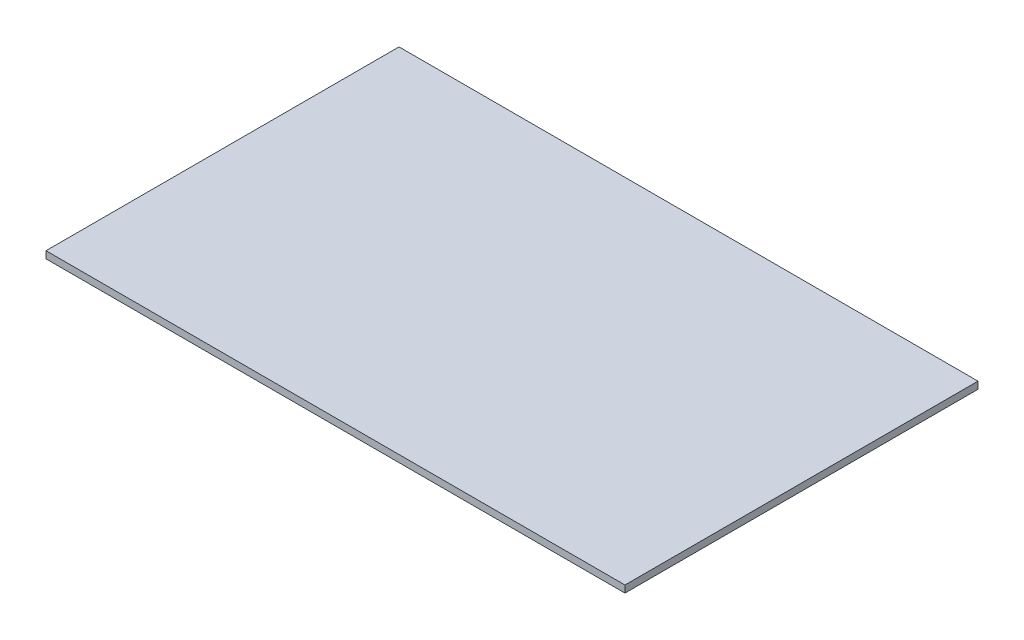
from build123d import *

# Parameters (mm, degrees)
ESBO_O1_W                = 82
ESBO_O1_H                = 50
RESSALTO_EXTRUS_O1_DEPTH = 1


with BuildPart() as part:
    # Esboço1 → Ressalto-extrusão1 (new body)
    with BuildSketch(Plane(origin=(0, 0, 0), x_dir=(1, 0, 0), z_dir=(0, 1, 0))):
        Rectangle(ESBO_O1_W, ESBO_O1_H)
    extrude(amount=RESSALTO_EXTRUS_O1_DEPTH)


solid = part.part
